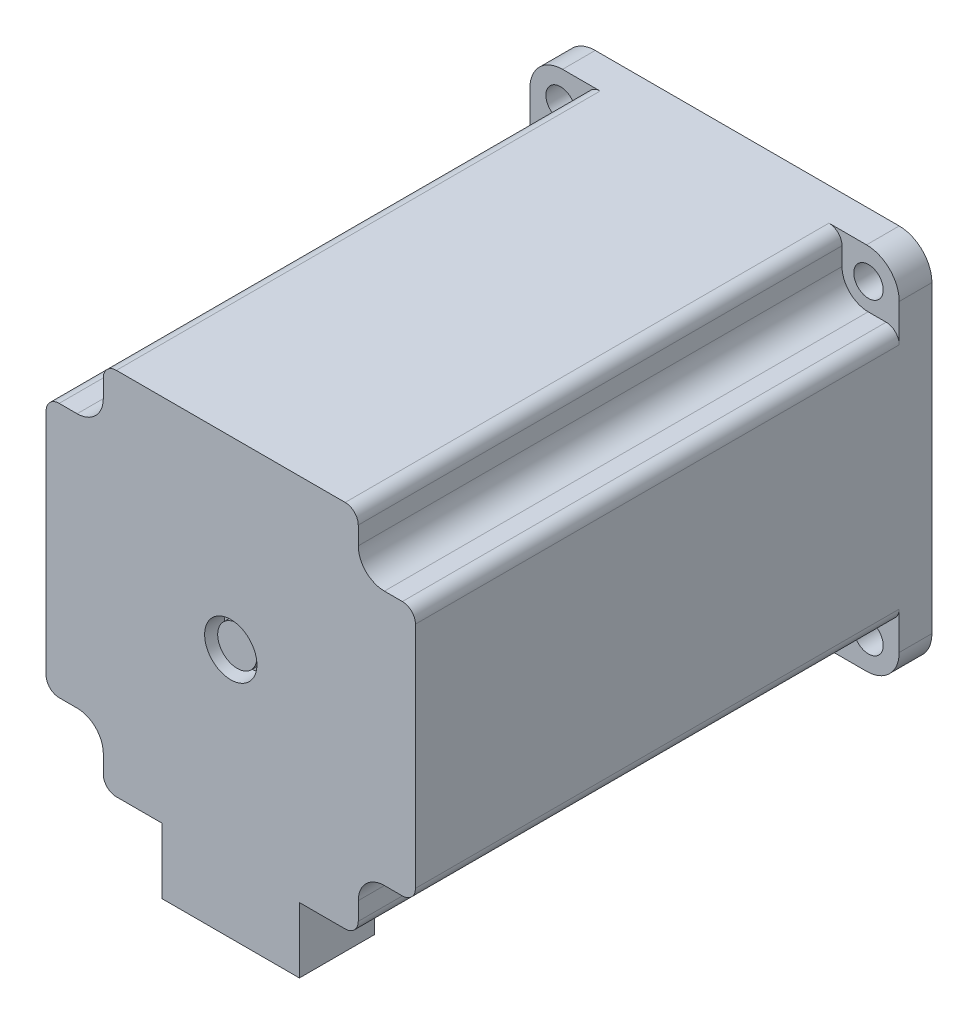
from build123d import *

# Parameters (mm, degrees)
SKETCH_1_W          = 56.5
SKETCH_1_H          = 56.5
EXTRUDE_1_DEPTH     = 79
FILLET_1_R          = 5
SKETCH_2_W          = 27.937414654
SKETCH_2_H          = 17.525111135
CUT_EXTRUDE_1_DEPTH = 74
FILLET_2_R          = 4
FILLET_3_R          = 2
SKETCH_3_R          = 19
EXTRUDE_2_DEPTH     = 1.5
SKETCH_4_R          = 4
CUT_EXTRUDE_2_DEPTH = 3
SKETCH_5_R          = 3
EXTRUDE_3_DEPTH     = 2
SKETCH_6_R          = 3.175
EXTRUDE_4_DEPTH     = 19
SKETCH_7_R          = 2.25
CUT_EXTRUDE_3_DEPTH = 21
SKETCH_8_W          = 21
SKETCH_8_H          = 11.5
EXTRUDE_5_DEPTH     = 10
SKETCH_9_W          = 12
SKETCH_9_H          = 3
CUT_EXTRUDE_4_DEPTH = 5
SKETCH_10_W         = 15
SKETCH_10_H         = 3.472611371
CUT_EXTRUDE_6_DEPTH = 113.36325022


with BuildPart() as part:
    # 草图1 → 凸台-拉伸1 (new body)
    with BuildSketch(Plane.XY):
        with Locations((28.25, 28.25)):
            Rectangle(SKETCH_1_W, SKETCH_1_H)
    extrude(amount=EXTRUDE_1_DEPTH)

    # 圆角1
    fillet_1_edges = [part.edges().sort_by_distance(p)[0] for p in [
        (0, 56.5, 39.5),
        (56.5, 56.5, 39.5),
        (56.5, 0, 39.5),
        (0, 0, 39.5),
    ]]
    fillet(fillet_1_edges, radius=FILLET_1_R)

    # 草图2 → 切除-拉伸1 (cut)
    with BuildSketch(Plane.XY.offset(79)):
        with Locations((-5.218707327, 56.512555568)):
            Rectangle(SKETCH_2_W, SKETCH_2_H)
        with Locations((61.718707327, 56.512555568)):
            Rectangle(SKETCH_2_W, SKETCH_2_H)
        with Locations((61.718707327, -0.012555568)):
            Rectangle(SKETCH_2_W, SKETCH_2_H)
        with Locations((-5.218707327, -0.012555568)):
            Rectangle(SKETCH_2_W, SKETCH_2_H)
    extrude(amount=-CUT_EXTRUDE_1_DEPTH, mode=Mode.SUBTRACT)

    # 圆角2
    fillet_2_edges = [part.edges().sort_by_distance(p)[0] for p in [
        (8.75, 47.75, 42),
        (47.75, 47.75, 42),
        (47.75, 8.75, 42),
        (8.75, 8.75, 42),
    ]]
    fillet(fillet_2_edges, radius=FILLET_2_R)

    # 圆角3
    fillet_3_edges = [part.edges().sort_by_distance(p)[0] for p in [
        (8.75, 56.5, 42),
        (0, 47.75, 42),
        (56.5, 47.75, 42),
        (47.75, 56.5, 42),
        (47.75, 0, 42),
        (56.5, 8.75, 42),
        (0, 8.75, 42),
        (8.75, 0, 42),
    ]]
    fillet(fillet_3_edges, radius=FILLET_3_R)

    # 草图3 → 凸台-拉伸2 (add)
    with BuildSketch(Plane(origin=(0, 0, 0), x_dir=(-1, 0, 0), z_dir=(0, 0, -1))):
        with Locations((-28.25, 28.25)):
            Circle(SKETCH_3_R)
    extrude(amount=EXTRUDE_2_DEPTH)

    # 草图4 → 切除-拉伸2 (cut)
    with BuildSketch(Plane.XY.offset(79)):
        with Locations((28.25, 28.25)):
            Circle(SKETCH_4_R)
    extrude(amount=-CUT_EXTRUDE_2_DEPTH, mode=Mode.SUBTRACT)

    # 草图5 → 凸台-拉伸3 (add)
    with BuildSketch(Plane.XY.offset(76)):
        with Locations((28.25, 28.25)):
            Circle(SKETCH_5_R)
    extrude(amount=EXTRUDE_3_DEPTH)

    # 草图6 → 凸台-拉伸4 (add)
    with BuildSketch(Plane(origin=(0, 0, -1.5), x_dir=(-1, 0, 0), z_dir=(0, 0, -1))):
        with Locations((-28.25, 28.25)):
            Circle(SKETCH_6_R)
    extrude(amount=EXTRUDE_4_DEPTH)

    # 草图7 → 切除-拉伸3 (cut)
    with BuildSketch(Plane(origin=(0, 0, 0), x_dir=(-1, 0, 0), z_dir=(0, 0, -1))):
        with Locations((-51.8, 4.7)):
            Circle(SKETCH_7_R)
        with Locations((-4.7, 4.7)):
            Circle(SKETCH_7_R)
        with Locations((-4.7, 51.8)):
            Circle(SKETCH_7_R)
        with Locations((-51.8, 51.8)):
            Circle(SKETCH_7_R)
    extrude(amount=-CUT_EXTRUDE_3_DEPTH, mode=Mode.SUBTRACT)

    # 草图8 → 凸台-拉伸5 (add)
    with BuildSketch(Plane.XZ):
        with Locations((28.25, 73.25)):
            Rectangle(SKETCH_8_W, SKETCH_8_H)
    extrude(amount=EXTRUDE_5_DEPTH)

    # 草图9 → 切除-拉伸4 (cut)
    with BuildSketch(Plane.XZ.offset(10)):
        with Locations((28.25, 70)):
            Rectangle(SKETCH_9_W, SKETCH_9_H)
    extrude(amount=-CUT_EXTRUDE_4_DEPTH, mode=Mode.SUBTRACT)

    # 草图10 → 切除-拉伸6 (cut, through all)
    with BuildSketch(Plane(origin=(0, 0, 0), x_dir=(0, 0, -1), z_dir=(1, 0, 0))):
        with Locations((13, 24.188694315)):
            Rectangle(SKETCH_10_W, SKETCH_10_H)
    extrude(amount=CUT_EXTRUDE_6_DEPTH, mode=Mode.SUBTRACT)


solid = part.part
